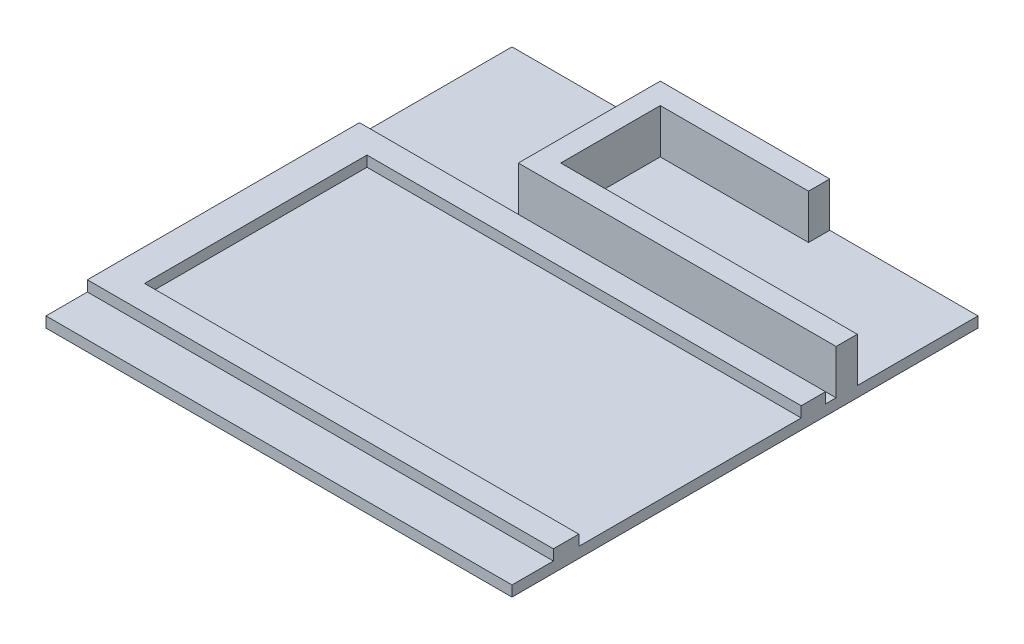
from build123d import *

# Parameters (mm, degrees)
SKETCH1_W           = 220
SKETCH1_H           = 220
BOSS_EXTRUDE1_DEPTH = 5
BOSS_EXTRUDE2_DEPTH = 21
BOSS_EXTRUDE3_DEPTH = 5


with BuildPart() as part:
    # Sketch1 → Boss-Extrude1 (new body)
    with BuildSketch(Plane(origin=(0, 0, 0), x_dir=(1, 0, 0), z_dir=(0, 1, 0))):
        Rectangle(SKETCH1_W, SKETCH1_H)
    extrude(amount=BOSS_EXTRUDE1_DEPTH)

    # Sketch2 → Boss-Extrude2 (add)
    with BuildSketch(Plane(origin=(0, 5, 0), x_dir=(1, 0, 0), z_dir=(0, 1, 0))):
        Polygon((-40, 110), (40, 110), (40, 100), (-30, 100), (-30, 53), (110, 53), (110, 43), (-40, 43), align=None)
    extrude(amount=BOSS_EXTRUDE2_DEPTH)

    # Sketch3 → Boss-Extrude3 (add)
    with BuildSketch(Plane(origin=(0, 5, 0), x_dir=(1, 0, 0), z_dir=(0, 1, 0))):
        Polygon((-110, 38), (110, 38), (110, 26.532503788), (-95, 26.532503788), (-95, -78.467496212), (110, -78.467496212), (110, -90.467496212), (-110, -90.467496212), align=None)
    extrude(amount=BOSS_EXTRUDE3_DEPTH)


solid = part.part
